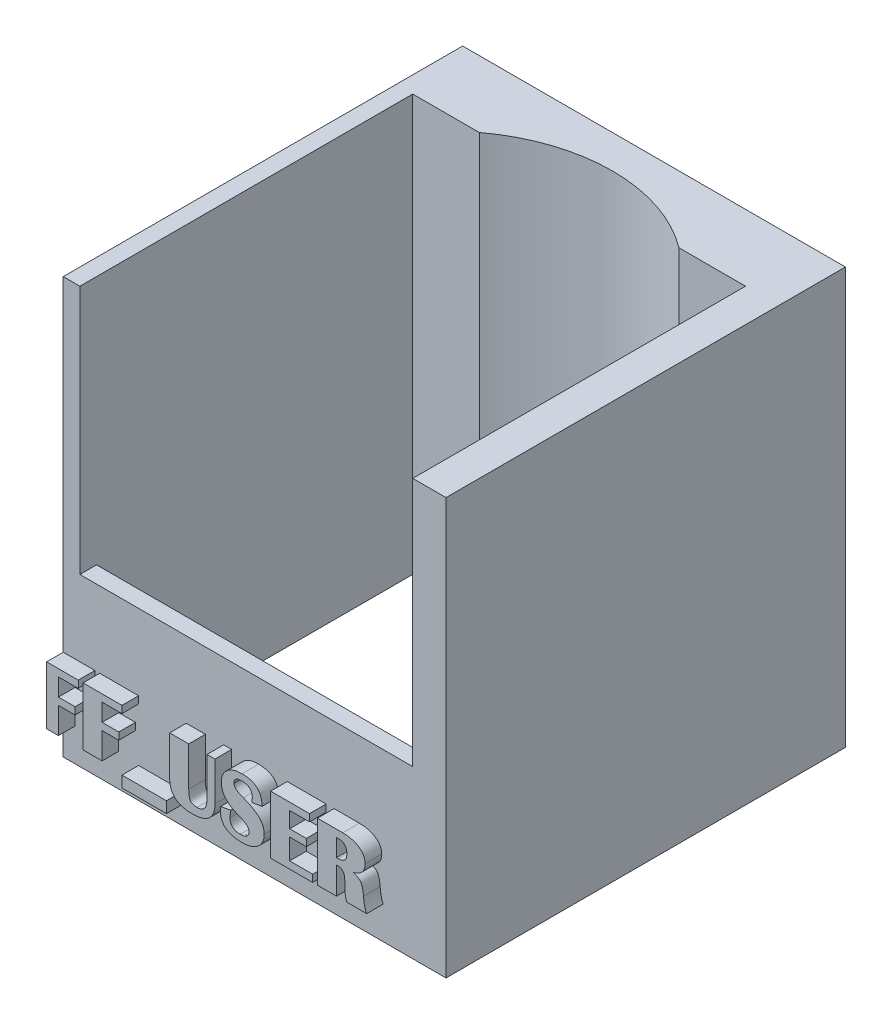
from build123d import *

# Parameters (mm, degrees)
SKETCH1_W                      = 670
SKETCH1_H                      = 120
BOSS_EXTRUDE1_DEPTH            = 530
SKETCH2_W                      = 100
SKETCH2_H                      = 200
SKETCH2_W_2                    = 650
SKETCH2_H_2                    = 250
CUT_EXTRUDE1_DEPTH             = 100
SKETCH3_R                      = 50
CUT_EXTRUDE2_DEPTH             = 260
F_12_0_12_DIAMETER_HOLE2_D     = 12
F_12_0_12_DIAMETER_HOLE2_DEPTH = 30
F_12_0_12_DIAMETER_HOLE2_TIP   = 3.605163714
SKETCH8_W                      = 650
SKETCH8_H                      = 50
BOSS_EXTRUDE2_DEPTH            = 5
SKETCH9_W                      = 10
SKETCH9_H                      = 250
CUT_EXTRUDE3_DEPTH             = 717
CUT_EXTRUDE4_DEPTH             = 5
SKETCH11_W                     = 10
SKETCH11_H                     = 100
BOSS_EXTRUDE3_DEPTH            = 78
BOSS_EXTRUDE3_2_DEPTH          = 78
BOSS_EXTRUDE3_3_DEPTH          = 78
SKETCH12_W                     = 20
SKETCH12_H                     = 30
CUT_EXTRUDE5_DEPTH             = 80
SKETCH15_W                     = 30
SKETCH15_H                     = 23.536156656
SKETCH15_H_2                   = 28.986603691
CUT_EXTRUDE7_DEPTH             = 35
SHELL1_T                       = -3
SKETCH16_W                     = 14
SKETCH16_H                     = 14
CUT_EXTRUDE8_DEPTH             = 35
SKETCH17_W                     = 5.729882812
SKETCH17_H                     = 17.428393554
SKETCH17_W_2                   = 13.369726562
SKETCH17_H_2                   = 3.342431641
BOSS_EXTRUDE4_DEPTH            = 5
SKETCH18_W                     = 670
SKETCH18_H                     = 280
CUT_EXTRUDE10_DEPTH            = 159
CUT_EXTRUDE12_DEPTH            = 59
CUT_EXTRUDE12_DEPTH_BACK       = 135
SKETCH19_W                     = 555
SKETCH19_H                     = 250
CUT_EXTRUDE13_DEPTH            = 863.670273187
CUT_EXTRUDE13_DEPTH_BACK       = 863.670273187
SKETCH20_W                     = 115
SKETCH20_H                     = 125


with BuildPart() as part:
    # Sketch1 → Boss-Extrude1 (new body)
    with BuildSketch(Plane(origin=(0, 0, 0), x_dir=(1, 0, 0), z_dir=(0, 1, 0))):
        with Locations((335, 60)):
            Rectangle(SKETCH1_W, SKETCH1_H)
    extrude(amount=BOSS_EXTRUDE1_DEPTH)

    # Sketch2 → Cut-Extrude1 (cut)
    with BuildSketch(Plane.XY):
        with Locations((60, 380)):
            Rectangle(SKETCH2_W, SKETCH2_H)
        with Locations((170, 380)):
            Rectangle(SKETCH2_W, SKETCH2_H)
        with Locations((280, 380)):
            Rectangle(SKETCH2_W, SKETCH2_H)
        with Locations((390, 380)):
            Rectangle(SKETCH2_W, SKETCH2_H)
        with Locations((500, 380)):
            Rectangle(SKETCH2_W, SKETCH2_H)
        with Locations((610, 380)):
            Rectangle(SKETCH2_W, SKETCH2_H)
        with Locations((335, 135)):
            Rectangle(SKETCH2_W_2, SKETCH2_H_2)
    extrude(amount=-CUT_EXTRUDE1_DEPTH, mode=Mode.SUBTRACT)

    # Sketch3 → Cut-Extrude2 (cut)
    with BuildSketch(Plane(origin=(0, 530, 0), x_dir=(1, 0, 0), z_dir=(0, 1, 0))):
        with Locations(Location((60, 60, 0), (0, 0, 270))):
            Circle(SKETCH3_R)
        with Locations(Location((170, 60, 0), (0, 0, 270))):
            Circle(SKETCH3_R)
        with Locations(Location((280, 60, 0), (0, 0, 270))):
            Circle(SKETCH3_R)
        with Locations(Location((390, 60, 0), (0, 0, 270))):
            Circle(SKETCH3_R)
        with Locations(Location((500, 60, 0), (0, 0, 270))):
            Circle(SKETCH3_R)
        with Locations(Location((610, 60, 0), (0, 0, 270))):
            Circle(SKETCH3_R)
    extrude(amount=-CUT_EXTRUDE2_DEPTH, mode=Mode.SUBTRACT)

    # Ø12.0 (12) Diameter Hole2
    with Locations(Plane(origin=(59.704642413, 270, -102.411697903), x_dir=(0, 0, 1), z_dir=(0, 1, 0))):
        with Locations((0, 0), (-0.195888006, 111.8520513), (0.014838595, 221.167624818), (-0.341843303, 331.364008353), (0.657723149, 441.008646429), (1.288998006, 549.811854685)):
            Hole(F_12_0_12_DIAMETER_HOLE2_D / 2, depth=F_12_0_12_DIAMETER_HOLE2_DEPTH)
            with Locations((0, 0, -(F_12_0_12_DIAMETER_HOLE2_DEPTH + F_12_0_12_DIAMETER_HOLE2_TIP / 2))):  # 118° drill point
                Cone(0, F_12_0_12_DIAMETER_HOLE2_D / 2, F_12_0_12_DIAMETER_HOLE2_TIP, mode=Mode.SUBTRACT)

    # Sketch8 → Boss-Extrude2 (add)
    with BuildSketch(Plane.XY):
        with Locations((335, 305)):
            Rectangle(SKETCH8_W, SKETCH8_H)
    extrude(amount=-BOSS_EXTRUDE2_DEPTH)

    # Sketch9 → Cut-Extrude3 (cut)
    with BuildSketch(Plane(origin=(670, 0, 0), x_dir=(0, 0, -1), z_dir=(1, 0, 0))):
        with Locations((15, 135)):
            Rectangle(SKETCH9_W, SKETCH9_H)
    extrude(amount=-CUT_EXTRUDE3_DEPTH, mode=Mode.SUBTRACT)

    # Sketch10 → Cut-Extrude4 (cut)
    with BuildSketch(Plane(origin=(0, 10, 0), x_dir=(1, 0, 0), z_dir=(0, 1, 0))):
        Polygon((365, 61.943560596), (350, 87.924322709), (320, 87.924322709), (305, 61.943560596), (320, 35.962798482), (350, 35.962798482), align=None)
    extrude(amount=-CUT_EXTRUDE4_DEPTH, mode=Mode.SUBTRACT)

    # Sketch12 → Cut-Extrude5 (cut)
    with BuildSketch(Plane.XY.offset(-100)):
        with Locations((85.198613037, 245)):
            Rectangle(SKETCH12_W, SKETCH12_H)
        with Locations((195.198613037, 245)):
            Rectangle(SKETCH12_W, SKETCH12_H)
        with Locations((305.198613037, 245)):
            Rectangle(SKETCH12_W, SKETCH12_H)
        with Locations((415.198613037, 245)):
            Rectangle(SKETCH12_W, SKETCH12_H)
        with Locations((525.198613037, 245)):
            Rectangle(SKETCH12_W, SKETCH12_H)
        with Locations((635.198613037, 245)):
            Rectangle(SKETCH12_W, SKETCH12_H)
    extrude(amount=-CUT_EXTRUDE5_DEPTH, mode=Mode.SUBTRACT)

    # Sketch17 → Boss-Extrude4 (add)
    # profile 1 of 9: a face of its own
    with BuildSketch(Plane.XY):
        with BuildLine():
            Line((527.508830928, 289.835452458), (527.508830928, 307.263846012))
            Line((527.508830928, 307.263846012), (534.861434459, 307.263846012))
            add(Edge.make_bspline(
                [(534.861434459, 307.263846012), (535.181337774, 307.258256848), (535.803061116, 307.24739446), (536.703508491, 307.139069344), (537.544992916, 306.975202489), (538.325061607, 306.737496792), (539.040841948, 306.426020155), (539.698044515, 306.051894954), (540.290333057, 305.605079277), (540.822348212, 305.090232636), (541.284521701, 304.502523111), (541.692171296, 303.852565801), (542.030284458, 303.129762281), (542.309377095, 302.341316546), (542.5243908, 301.484161689), (542.679660381, 300.560045938), (542.773357357, 299.567500804), (542.783368073, 298.883107022), (542.788518428, 298.530997273)],
                knots=[0, 0, 0, 0, 1.135059408, 2.20595691, 3.214417064, 4.174978569, 5.094187092, 5.980001006, 6.853065862, 7.720814779, 8.600404634, 9.50058483, 10.438414914, 11.426825708, 12.465239141, 13.571113463, 14.750376389, 16, 16, 16, 16], degree=3))
            add(Edge.make_bspline(
                [(542.788518428, 298.530997273), (542.781740751, 298.180151665), (542.768592871, 297.499553336), (542.676885992, 296.511518461), (542.516733301, 295.591080531), (542.296748778, 294.736450427), (542.003051046, 293.953120444), (541.654236167, 293.233205539), (541.233025793, 292.585291498), (540.753136904, 292.000029304), (540.204772188, 291.484681411), (539.587651059, 291.044279297), (538.910779309, 290.668464036), (538.169670382, 290.361903209), (537.364073889, 290.124869172), (536.495133477, 289.954199984), (535.562644449, 289.853487388), (534.920131033, 289.841584621), (534.58911581, 289.835452458)],
                knots=[0, 0, 0, 0, 1.228418252, 2.382983832, 3.470276728, 4.496757894, 5.468023682, 6.394867725, 7.292157164, 8.167372942, 9.039072913, 9.918728341, 10.815246345, 11.744296628, 12.720973084, 13.750736166, 14.841206188, 16, 16, 16, 16], degree=3))
            Line((534.58911581, 289.835452458), (527.508830928, 289.835452458))
        make_face()
        with BuildLine():
            Line((533.238713741, 291.745413395), (534.048208904, 291.745413395))
            add(Edge.make_bspline(
                [(534.048208904, 291.745413395), (534.172894012, 291.749291978), (534.413033311, 291.756761998), (534.758676231, 291.825976613), (535.075745017, 291.938271137), (535.365749176, 292.094802589), (535.623404602, 292.300450923), (535.848862806, 292.551404902), (536.04776914, 292.844737637), (536.217685755, 293.190205032), (536.364284647, 293.596533622), (536.481764702, 294.076367921), (536.592118304, 294.630928744), (536.673672739, 295.265507643), (536.740044562, 295.978448886), (536.788346679, 296.768428292), (536.812018936, 297.636801208), (536.817188964, 298.241258393), (536.819890499, 298.55711002)],
                knots=[0, 0, 0, 0, 0.728710832, 1.403472396, 2.052289494, 2.690292559, 3.321919393, 3.970736491, 4.656696891, 5.388631723, 6.217040872, 7.17856157, 8.275589967, 9.523440737, 10.918935818, 12.463926104, 14.152268318, 16, 16, 16, 16], degree=3))
            add(Edge.make_bspline(
                [(536.819890499, 298.55711002), (536.8171426, 298.871715251), (536.811863063, 299.476166083), (536.7886758, 300.343334385), (536.739579947, 301.133216935), (536.674703848, 301.843934916), (536.589660404, 302.476324031), (536.488366458, 303.031681737), (536.362441588, 303.507627045), (536.222158727, 303.914921549), (536.050140993, 304.256514038), (535.858357073, 304.554097881), (535.62547107, 304.79746827), (535.36991257, 305.004888479), (535.079348843, 305.160875844), (534.761320266, 305.273944358), (534.414185903, 305.34216807), (534.172870641, 305.349893944), (534.048208904, 305.353885075)],
                knots=[0, 0, 0, 0, 1.842836665, 3.540640921, 5.080358154, 6.47765669, 7.719902824, 8.816971715, 9.781579111, 10.601733135, 11.334613876, 12.017393917, 12.666641099, 13.29908421, 13.937911793, 14.587567384, 15.270347425, 16, 16, 16, 16], degree=3))
            Line((534.048208904, 305.353885075), (533.238713741, 305.353885075))
            Line((533.238713741, 305.353885075), (533.238713741, 291.745413395))
        make_face(mode=Mode.SUBTRACT)
    # profile 2 of 9: a face of its own
    with BuildSketch(Plane.XY):
        with Locations((547.563420772, 298.549649235)):
            Rectangle(SKETCH17_W, SKETCH17_H)
    # profile 3 of 9: a face of its own
    with BuildSketch(Plane.XY):
        Polygon((564.514324092, 307.263846012), (564.514324092, 305.115139958), (558.545696163, 305.115139958), (558.545696163, 299.862747379), (563.559343624, 299.862747379), (563.559343624, 297.714041325), (558.545696163, 297.714041325), (558.545696163, 289.835452458), (552.81581335, 289.835452458), (552.81581335, 307.263846012), align=None)
    # profile 4 of 9: a face of its own
    with BuildSketch(Plane.XY):
        Polygon((577.645305538, 307.263846012), (577.645305538, 305.115139958), (571.676677608, 305.115139958), (571.676677608, 299.862747379), (576.690325069, 299.862747379), (576.690325069, 297.714041325), (571.676677608, 297.714041325), (571.676677608, 289.835452458), (565.946794795, 289.835452458), (565.946794795, 307.263846012), align=None)
    # profile 5 of 9: a face of its own
    with BuildSketch(Plane.XY):
        with Locations((584.330168819, 287.448001286)):
            Rectangle(SKETCH17_W_2, SKETCH17_H_2)
    # profile 6 of 9: a face of its own
    with BuildSketch(Plane.XY):
        with BuildLine():
            Line((605.578484249, 307.263846012), (605.578484249, 295.602639195))
            add(Edge.make_bspline(
                [(605.578484249, 295.602639195), (605.574209777, 295.35989389), (605.565919345, 294.889083964), (605.480877158, 294.20653885), (605.349958188, 293.569747554), (605.15926554, 292.978838165), (604.911867049, 292.436847071), (604.616163877, 291.936663973), (604.260702644, 291.487723021), (603.847299908, 291.08966617), (603.386881991, 290.731670113), (602.867295001, 290.425440037), (602.293741958, 290.168488385), (601.66690529, 289.960990771), (600.988052682, 289.797299786), (600.254912883, 289.679078851), (599.467035781, 289.60781007), (598.923618241, 289.60048219), (598.643684673, 289.59670734)],
                knots=[0, 0, 0, 0, 1.108173197, 2.149326602, 3.136215123, 4.073726706, 4.978516626, 5.852185058, 6.72141202, 7.584905625, 8.467554395, 9.379216169, 10.332422268, 11.332766067, 12.390653242, 13.518530507, 14.721707419, 16, 16, 16, 16], degree=3))
            add(Edge.make_bspline(
                [(598.643684673, 289.59670734), (598.373688491, 289.600411437), (597.851346557, 289.607577482), (597.093280473, 289.679448684), (596.387523889, 289.797736542), (595.733050135, 289.960122315), (595.130189942, 290.169220301), (594.579048171, 290.42623041), (594.078350789, 290.732835498), (593.633858028, 291.090104794), (593.234289459, 291.486851767), (592.899913678, 291.940746827), (592.609043638, 292.435866034), (592.375223767, 292.980322997), (592.191754821, 293.570441519), (592.063541006, 294.20666921), (591.983676196, 294.889343196), (591.974661767, 295.359932437), (591.970012569, 295.602639195)],
                knots=[0, 0, 0, 0, 1.258901956, 2.435505865, 3.547148904, 4.59359074, 5.576649289, 6.5183682, 7.424469602, 8.307507093, 9.172751023, 10.042627298, 10.928839176, 11.845659241, 12.799442865, 13.80597989, 14.868432463, 16, 16, 16, 16], degree=3))
            Line((591.970012569, 295.602639195), (591.970012569, 307.263846012))
            Line((591.970012569, 307.263846012), (597.699895381, 307.263846012))
            Line((597.699895381, 307.263846012), (597.699895381, 295.457153889))
            add(Edge.make_bspline(
                [(597.699895381, 295.457153889), (597.700816195, 295.287996189), (597.702584578, 294.963135903), (597.729908723, 294.499051493), (597.768241004, 294.079064133), (597.828226169, 293.705517832), (597.90066041, 293.377063412), (597.989882091, 293.09281535), (598.094998068, 292.852496478), (598.225239063, 292.654232043), (598.380826623, 292.495135011), (598.55368342, 292.353231761), (598.757556996, 292.238543846), (598.987648905, 292.146224908), (599.243380948, 292.070549638), (599.526120553, 292.020376099), (599.83553351, 291.990763905), (600.049971942, 291.986424568), (600.161954402, 291.984158512)],
                knots=[0, 0, 0, 0, 1.622370975, 3.115695595, 4.458049099, 5.666011203, 6.742434742, 7.681714947, 8.519814998, 9.250928664, 9.942747364, 10.646898194, 11.389596108, 12.175933929, 13.021386247, 13.943159715, 14.925891993, 16, 16, 16, 16], degree=3))
            add(Edge.make_bspline(
                [(600.161954402, 291.984158512), (600.283927219, 291.987190593), (600.521124756, 291.993087005), (600.86597014, 292.03390861), (601.187714881, 292.103380086), (601.484890424, 292.205377303), (601.758665297, 292.332852529), (602.012761516, 292.484567923), (602.236391413, 292.674631152), (602.439076761, 292.888441291), (602.620738276, 293.128529789), (602.771757722, 293.399928575), (602.905501548, 293.697121508), (603.005823683, 294.025060118), (603.089837826, 294.379999499), (603.146989706, 294.763086929), (603.186210275, 295.174074524), (603.189394751, 295.457053988), (603.191033077, 295.602639195)],
                knots=[0, 0, 0, 0, 1.083870311, 2.107775948, 3.08105344, 4.003637981, 4.893545291, 5.761570557, 6.624657808, 7.49233129, 8.376387281, 9.291996285, 10.246843261, 11.267344133, 12.334180325, 13.486053461, 14.706643157, 16, 16, 16, 16], degree=3))
            Line((603.191033077, 295.602639195), (603.191033077, 307.263846012))
            Line((603.191033077, 307.263846012), (605.578484249, 307.263846012))
        make_face()
    # profile 7 of 9: a face of its own
    with BuildSketch(Plane.XY):
        with BuildLine():
            Line((619.731593227, 302.015183827), (616.739818477, 301.526502415))
            add(Edge.make_bspline(
                [(616.739818477, 301.526502415), (616.748849224, 301.670726223), (616.765660669, 301.939210177), (616.78429066, 302.312269209), (616.796668381, 302.625642376), (616.798628236, 302.814722915), (616.799504756, 302.899286839)],
                knots=[0, 0, 0, 0, 1.261802504, 2.348944521, 3.261585937, 4, 4, 4, 4], degree=3))
            add(Edge.make_bspline(
                [(616.799504756, 302.899286839), (616.798306068, 303.007660677), (616.795968139, 303.219033721), (616.750451916, 303.523894877), (616.694806916, 303.811547356), (616.604352699, 304.076787391), (616.488181329, 304.320314265), (616.348943917, 304.543955606), (616.184187178, 304.745078709), (615.995833421, 304.928129987), (615.778009957, 305.083200131), (615.536269472, 305.218702836), (615.269765326, 305.333844758), (614.978065514, 305.431346685), (614.660683072, 305.504624438), (614.319025281, 305.556776695), (613.952471696, 305.585673441), (613.699597795, 305.590260771), (613.568984889, 305.592630192)],
                knots=[0, 0, 0, 0, 1.079280541, 2.105035848, 3.067950317, 3.99715044, 4.889989748, 5.753421302, 6.617030865, 7.476358039, 8.364190572, 9.274590025, 10.235106994, 11.254473582, 12.337095886, 13.478601727, 14.697662529, 16, 16, 16, 16], degree=3))
            add(Edge.make_bspline(
                [(613.568984889, 305.592630192), (613.391954632, 305.58912286), (613.059112606, 305.582528579), (612.595688488, 305.495339748), (612.198743126, 305.361419257), (611.87165349, 305.163811893), (611.613188167, 304.909795747), (611.433841092, 304.593316589), (611.323009072, 304.224665915), (611.313400221, 303.959558324), (611.308367061, 303.820693775)],
                knots=[0, 0, 0, 0, 1.294917039, 2.43462794, 3.440028966, 4.347597256, 5.210608309, 6.06356377, 6.985685997, 8, 8, 8, 8], degree=3))
            add(Edge.make_bspline(
                [(611.308367061, 303.820693775), (611.317562032, 303.705133219), (611.336106628, 303.472068433), (611.47315858, 303.132808312), (611.695999602, 302.811560885), (612.009295906, 302.510664216), (612.404107796, 302.221967273), (612.884407504, 301.948533431), (613.450813789, 301.688189695), (613.862519081, 301.536023727), (614.080048656, 301.455624958)],
                knots=[0, 0, 0, 0, 0.716839541, 1.445735977, 2.240793036, 3.131329288, 4.131129903, 5.273471266, 6.559404876, 8, 8, 8, 8], degree=3))
            add(Edge.make_bspline(
                [(614.080048656, 301.455624958), (614.335934702, 301.364918412), (614.834564244, 301.188164095), (615.547657928, 300.88707802), (616.213068388, 300.5749594), (616.829579094, 300.246613346), (617.397833174, 299.90520698), (617.914851624, 299.544556457), (618.386199073, 299.173962102), (618.807001026, 298.783874588), (619.177995113, 298.378100064), (619.4958685, 297.952745357), (619.771807525, 297.51723103), (619.991113975, 297.061458502), (620.169645242, 296.594624218), (620.292698657, 296.11024444), (620.364288243, 295.609761088), (620.37516617, 295.270864226), (620.380681514, 295.099036213)],
                knots=[0, 0, 0, 0, 1.359488612, 2.649152603, 3.874964776, 5.039588756, 6.146130126, 7.193090393, 8.194917302, 9.146793662, 10.063845301, 10.944476293, 11.803344532, 12.641736646, 13.473440096, 14.302714936, 15.139439897, 16, 16, 16, 16], degree=3))
            add(Edge.make_bspline(
                [(620.380681514, 295.099036213), (620.374476075, 294.902306495), (620.362285176, 294.515820995), (620.280160209, 293.948630617), (620.138011896, 293.409496554), (619.938489338, 292.895972278), (619.681049879, 292.411946655), (619.366518754, 291.954381076), (618.996510229, 291.525099427), (618.5710008, 291.128381035), (618.102222518, 290.765302239), (617.587803957, 290.450854345), (617.034458515, 290.187092261), (616.444107988, 289.968993032), (615.81453624, 289.801373099), (615.145337453, 289.685291013), (614.438790193, 289.606619894), (613.954683001, 289.600062276), (613.70700941, 289.59670734)],
                knots=[0, 0, 0, 0, 0.972121714, 1.909782367, 2.824924061, 3.721832975, 4.62620438, 5.527836938, 6.46026819, 7.421000932, 8.398101015, 9.385579713, 10.394244048, 11.422703992, 12.491421888, 13.608778581, 14.776629625, 16, 16, 16, 16], degree=3))
            add(Edge.make_bspline(
                [(613.70700941, 289.59670734), (613.445745367, 289.599650312), (612.939893069, 289.605348413), (612.207608113, 289.66709241), (611.525297432, 289.760984454), (610.893395078, 289.899706116), (610.309273131, 290.072394336), (609.776099392, 290.288320955), (609.295310255, 290.547303481), (608.863217672, 290.843007892), (608.478306623, 291.175775461), (608.148120946, 291.551766865), (607.86942369, 291.967163224), (607.639947144, 292.421521488), (607.466477665, 292.917583541), (607.339164663, 293.449829748), (607.264537999, 294.021332449), (607.254747521, 294.414908557), (607.249700069, 294.617815586)],
                knots=[0, 0, 0, 0, 1.342201143, 2.598733168, 3.773451092, 4.878874364, 5.91991243, 6.900006476, 7.829142054, 8.72062616, 9.585588575, 10.436728592, 11.283829734, 12.149664931, 13.044964919, 13.977937424, 14.957531465, 16, 16, 16, 16], degree=3))
            add(Edge.make_bspline(
                [(607.249700069, 294.617815586), (607.250803815, 294.692425759), (607.253213998, 294.855347393), (607.260452266, 295.122772538), (607.275636683, 295.433682216), (607.29037174, 295.656130545), (607.298195171, 295.774237248)],
                knots=[0, 0, 0, 0, 0.773500207, 1.689044709, 2.77302154, 4, 4, 4, 4], degree=3))
            Line((607.298195171, 295.774237248), (610.36457777, 296.337526509))
            add(Edge.make_bspline(
                [(610.36457777, 296.337526509), (610.326952988, 296.136337493), (610.255606535, 295.754830366), (610.178678473, 295.21219969), (610.124206629, 294.733311493), (610.11767002, 294.435147371), (610.114641475, 294.297001835)],
                knots=[0, 0, 0, 0, 1.192988372, 2.262218769, 3.194850416, 4, 4, 4, 4], degree=3))
            add(Edge.make_bspline(
                [(610.114641475, 294.297001835), (610.116191817, 294.183708768), (610.119182568, 293.965156219), (610.159053378, 293.648552813), (610.215988606, 293.352999663), (610.302906772, 293.079707227), (610.411206928, 292.826307836), (610.544682453, 292.59538211), (610.704385489, 292.386485019), (610.887496571, 292.200099922), (611.094689168, 292.033628705), (611.327456494, 291.892756696), (611.58347653, 291.771733922), (611.864681562, 291.677479524), (612.167961721, 291.596080628), (612.497219749, 291.548235723), (612.849461228, 291.512043782), (613.092629543, 291.508500084), (613.218327999, 291.506668278)],
                knots=[0, 0, 0, 0, 1.135776692, 2.191015738, 3.19649269, 4.151244236, 5.061952528, 5.956281389, 6.819534407, 7.692823504, 8.571441916, 9.478554956, 10.416037156, 11.406231466, 12.450054172, 13.561596327, 14.739541482, 16, 16, 16, 16], degree=3))
            add(Edge.make_bspline(
                [(613.218327999, 291.506668278), (613.423996012, 291.510791273), (613.810619321, 291.518541853), (614.349272542, 291.616708407), (614.810575885, 291.768742445), (615.189785268, 291.991387532), (615.490778961, 292.278756613), (615.698005174, 292.637320004), (615.824813318, 293.05638326), (615.837728413, 293.355975238), (615.844524288, 293.513619419)],
                knots=[0, 0, 0, 0, 1.308765556, 2.460272085, 3.475015317, 4.388076298, 5.239673503, 6.095681635, 6.997954785, 8, 8, 8, 8], degree=3))
            add(Edge.make_bspline(
                [(615.844524288, 293.513619419), (615.833808824, 293.638242951), (615.811807312, 293.894126055), (615.644884004, 294.264515838), (615.382382362, 294.620631473), (615.016807277, 294.962984909), (614.551376589, 295.293471235), (613.986957743, 295.616730224), (613.322148235, 295.933112033), (612.83677959, 296.119639164), (612.580430889, 296.21815395)],
                knots=[0, 0, 0, 0, 0.667930748, 1.371427933, 2.146459016, 3.034714139, 4.04893387, 5.207327294, 6.525042705, 8, 8, 8, 8], degree=3))
            add(Edge.make_bspline(
                [(612.580430889, 296.21815395), (612.374354345, 296.29679374), (611.970646869, 296.450850434), (611.394079385, 296.713586304), (610.853066711, 296.987016804), (610.357486361, 297.288235735), (609.896382561, 297.599610528), (609.477036946, 297.932256792), (609.09841673, 298.284556341), (608.758710772, 298.653375077), (608.457302107, 299.038989264), (608.199448649, 299.444659231), (607.977533299, 299.866789834), (607.798609588, 300.308107488), (607.65975715, 300.767821241), (607.559616231, 301.244439392), (607.497905054, 301.739995674), (607.491630423, 302.075933546), (607.488445186, 302.246468159)],
                knots=[0, 0, 0, 0, 1.249558333, 2.447906163, 3.58867143, 4.682264114, 5.731748367, 6.739728761, 7.711906036, 8.659384707, 9.578321416, 10.481344598, 11.379544271, 12.277135726, 13.175418307, 14.097160112, 15.034047388, 16, 16, 16, 16], degree=3))
            add(Edge.make_bspline(
                [(607.488445186, 302.246468159), (607.49282555, 302.439538736), (607.501402184, 302.817565692), (607.587451154, 303.36980586), (607.719291893, 303.894921371), (607.910558542, 304.389343064), (608.156192894, 304.852853762), (608.453187669, 305.288766511), (608.804241719, 305.697593471), (609.213503754, 306.066686531), (609.657214714, 306.407618241), (610.14376173, 306.697651931), (610.658716537, 306.950861947), (611.210636666, 307.148827868), (611.791820619, 307.313252612), (612.408080529, 307.421140415), (613.056315391, 307.490701612), (613.499160755, 307.498567824), (613.725661373, 307.502591129)],
                knots=[0, 0, 0, 0, 1.01033566, 1.978209831, 2.919499157, 3.840961976, 4.746855014, 5.660740114, 6.597989116, 7.56120833, 8.541877795, 9.523498025, 10.522416858, 11.542172371, 12.589598349, 13.681636521, 14.814234488, 16, 16, 16, 16], degree=3))
            add(Edge.make_bspline(
                [(613.725661373, 307.502591129), (613.968269855, 307.498219033), (614.438190994, 307.489750488), (615.120391152, 307.426787419), (615.755073228, 307.319142339), (616.345153155, 307.171557286), (616.887304575, 306.977590666), (617.384933999, 306.742393454), (617.834452216, 306.46201507), (618.236961315, 306.139451502), (618.593086714, 305.773322851), (618.897467704, 305.361641069), (619.158701245, 304.909408454), (619.366684143, 304.412232174), (619.529870326, 303.873247147), (619.649133834, 303.29158184), (619.720420497, 302.667301443), (619.72779778, 302.236712324), (619.731593227, 302.015183827)],
                knots=[0, 0, 0, 0, 1.248314423, 2.417925914, 3.521398822, 4.558068205, 5.543720209, 6.479599284, 7.385061127, 8.263440163, 9.127722873, 10.00561236, 10.891325273, 11.808802823, 12.772251995, 13.784947978, 14.860405143, 16, 16, 16, 16], degree=3))
        make_face()
    # profile 8 of 9: a face of its own
    with BuildSketch(Plane.XY):
        Polygon((633.989153194, 307.263846012), (633.989153194, 305.115139958), (628.020525264, 305.115139958), (628.020525264, 300.340237614), (633.034172725, 300.340237614), (633.034172725, 298.191531559), (628.020525264, 298.191531559), (628.020525264, 291.984158512), (634.944133663, 291.984158512), (634.944133663, 289.835452458), (622.290642452, 289.835452458), (622.290642452, 307.263846012), align=None)
    # profile 9 of 9: a face of its own
    with BuildSketch(Plane.XY):
        with BuildLine():
            Line((636.376604366, 289.835452458), (636.376604366, 307.263846012))
            Line((636.376604366, 307.263846012), (643.990335369, 307.263846012))
            add(Edge.make_bspline(
                [(643.990335369, 307.263846012), (644.237946498, 307.261150834), (644.721600887, 307.25588639), (645.426490561, 307.189203683), (646.094808274, 307.090496236), (646.724915796, 306.949857504), (647.317873659, 306.767252686), (647.871119087, 306.542146), (648.390701058, 306.282329135), (648.864494846, 305.976472528), (649.295093616, 305.642889252), (649.669668547, 305.279483604), (649.990389523, 304.894749072), (650.250664962, 304.483256345), (650.454275633, 304.048690948), (650.59581384, 303.587791605), (650.684089268, 303.104102537), (650.695510601, 302.772834174), (650.701311397, 302.604585835)],
                knots=[0, 0, 0, 0, 1.303269877, 2.545653735, 3.724355284, 4.8584284, 5.941462088, 6.987020715, 8.000098032, 8.995332524, 9.951400474, 10.863507538, 11.737823931, 12.582415999, 13.420128714, 14.25671499, 15.114600608, 16, 16, 16, 16], degree=3))
            add(Edge.make_bspline(
                [(650.701311397, 302.604585835), (650.698282873, 302.472674957), (650.692382063, 302.215658276), (650.651041486, 301.838684287), (650.580643818, 301.480313933), (650.481036683, 301.139915259), (650.347814833, 300.820175594), (650.191279492, 300.517863507), (650.009772227, 300.230553342), (649.788675198, 299.970497982), (649.548268341, 299.722842359), (649.274558803, 299.497116911), (648.974487035, 299.288655528), (648.642526299, 299.104010513), (648.287619671, 298.928055749), (647.899038177, 298.784921972), (647.486819978, 298.644749395), (647.19793098, 298.577036306), (647.049257183, 298.54218845)],
                knots=[0, 0, 0, 0, 1.057156483, 2.059775939, 3.035078039, 3.981068617, 4.897189472, 5.80650904, 6.70770952, 7.613691521, 8.536886357, 9.470937334, 10.45233069, 11.461024139, 12.51295332, 13.623444893, 14.776929983, 16, 16, 16, 16], degree=3))
            add(Edge.make_bspline(
                [(647.049257183, 298.54218845), (647.19164695, 298.499279419), (647.467865022, 298.416041346), (647.856360945, 298.265600017), (648.211652989, 298.111536308), (648.524185739, 297.936781388), (648.807636894, 297.762122504), (649.047122259, 297.564301324), (649.255235567, 297.361673563), (649.425188343, 297.135464734), (649.570253643, 296.882344437), (649.694827156, 296.586596707), (649.815179167, 296.247423665), (649.917667348, 295.859098311), (650.004750555, 295.423699276), (650.088222437, 294.944027189), (650.153853601, 294.416024546), (650.187587341, 294.048412906), (650.2051692, 293.856815525)],
                knots=[0, 0, 0, 0, 1.149282524, 2.229462177, 3.219229774, 4.139917433, 4.995948464, 5.788695735, 6.536448429, 7.236319808, 7.968460079, 8.78645307, 9.713791991, 10.749194692, 11.887975363, 13.146018663, 14.512518948, 16, 16, 16, 16], degree=3))
            add(Edge.make_bspline(
                [(650.2051692, 293.856815525), (650.225980287, 293.627849833), (650.265975604, 293.187817268), (650.348933081, 292.554613589), (650.44386163, 291.974357025), (650.555874504, 291.44528724), (650.681301216, 290.967898855), (650.821280597, 290.540469593), (650.979920039, 290.165788217), (651.10484481, 289.941461656), (651.163880062, 289.835452458)],
                knots=[0, 0, 0, 0, 1.324580516, 2.545615266, 3.678710841, 4.711533017, 5.660403917, 6.521349952, 7.301239649, 8, 8, 8, 8], degree=3))
            Line((651.163880062, 289.835452458), (645.213904094, 289.835452458))
            add(Edge.make_bspline(
                [(645.213904094, 289.835452458), (645.12229736, 290.069847279), (644.935171241, 290.548648246), (644.7595281, 291.319414791), (644.64846922, 292.142514735), (644.635117598, 292.70994511), (644.628232479, 293.002555653)],
                knots=[0, 0, 0, 0, 0.930410518, 1.900560147, 2.917368081, 4, 4, 4, 4], degree=3))
            Line((644.628232479, 293.002555653), (644.605850124, 294.002300831))
            Line((644.605850124, 294.002300831), (644.579737377, 295.266903874))
            add(Edge.make_bspline(
                [(644.579737377, 295.266903874), (644.573694669, 295.477395004), (644.562357007, 295.872330118), (644.469348432, 296.426164013), (644.30178735, 296.894645884), (644.073222546, 297.287223005), (643.766741442, 297.590613479), (643.39104803, 297.804152917), (642.950456912, 297.93396284), (642.634664848, 297.946292392), (642.468335247, 297.952786442)],
                knots=[0, 0, 0, 0, 1.295300309, 2.430314163, 3.439929415, 4.342995669, 5.203512789, 6.060756153, 6.978588463, 8, 8, 8, 8], degree=3))
            Line((642.468335247, 297.952786442), (642.106487178, 297.952786442))
            Line((642.106487178, 297.952786442), (642.106487178, 289.835452458))
            Line((642.106487178, 289.835452458), (636.376604366, 289.835452458))
        make_face()
        with BuildLine():
            Line((642.106487178, 299.862747379), (642.617550945, 299.862747379))
            add(Edge.make_bspline(
                [(642.617550945, 299.862747379), (642.722054451, 299.865172716), (642.925280724, 299.869889229), (643.220054897, 299.898289891), (643.494111408, 299.951809873), (643.749840966, 300.021017819), (643.984372137, 300.114851792), (644.200147241, 300.225818296), (644.391160406, 300.362685327), (644.565327067, 300.516342321), (644.718148635, 300.691986294), (644.850351299, 300.889034217), (644.961199162, 301.106225057), (645.056078491, 301.342818683), (645.125883912, 301.600830857), (645.173262731, 301.879472914), (645.203404658, 302.177423605), (645.207875435, 302.383174491), (645.210173702, 302.488943669)],
                knots=[0, 0, 0, 0, 1.184986479, 2.304423995, 3.352332712, 4.347714965, 5.303263624, 6.211353909, 7.091434645, 7.960150225, 8.839440182, 9.723126897, 10.64371617, 11.599264829, 12.608232147, 13.667459739, 14.800924404, 16, 16, 16, 16], degree=3))
            add(Edge.make_bspline(
                [(645.210173702, 302.488943669), (645.207875435, 302.594712847), (645.203404658, 302.800463732), (645.173262731, 303.098414423), (645.125883912, 303.37705648), (645.056078491, 303.635068654), (644.961199162, 303.87166228), (644.850351299, 304.08885312), (644.718148635, 304.285901043), (644.565327067, 304.461545017), (644.391160406, 304.61520201), (644.200147241, 304.752069041), (643.984372137, 304.863035546), (643.749840966, 304.956869518), (643.494111408, 305.026077464), (643.220054897, 305.079597446), (642.925280724, 305.107998108), (642.722054451, 305.112714621), (642.617550945, 305.115139958)],
                knots=[0, 0, 0, 0, 1.199075596, 2.332540261, 3.391767853, 4.400735171, 5.35628383, 6.276873103, 7.160559818, 8.039849775, 8.908565355, 9.788646091, 10.696736376, 11.652285035, 12.647667288, 13.695576005, 14.815013521, 16, 16, 16, 16], degree=3))
            Line((642.617550945, 305.115139958), (642.106487178, 305.115139958))
            Line((642.106487178, 305.115139958), (642.106487178, 299.862747379))
        make_face(mode=Mode.SUBTRACT)
    extrude(amount=BOSS_EXTRUDE4_DEPTH)


with BuildPart() as body_2:
    # Sketch11 → Boss-Extrude3 (new body)
    with BuildSketch(Plane.XY.offset(-100)):
        with Locations((255, 60)):
            Rectangle(SKETCH11_W, SKETCH11_H)
    extrude(amount=BOSS_EXTRUDE3_DEPTH)


with BuildPart() as body_3:
    # Sketch11 → Boss-Extrude3 2 (new body)
    with BuildSketch(Plane.XY.offset(-100)):
        with Locations((415, 60)):
            Rectangle(SKETCH11_W, SKETCH11_H)
    extrude(amount=BOSS_EXTRUDE3_2_DEPTH)


with BuildPart() as body_4:
    # Sketch11 → Boss-Extrude3 3 (new body)
    with BuildSketch(Plane.XY.offset(-100)):
        Polygon((25, 198.45686471), (325, 145.558770497), (325, 122.01775856), (345, 122.01775856), (345, 145.558770497), (645, 198.45686471), align=None)
    extrude(amount=BOSS_EXTRUDE3_3_DEPTH)

    # Sketch15 → Cut-Extrude7 (cut)
    with BuildSketch(Plane(origin=(345, 0, 0), x_dir=(0, 0, -1), z_dir=(1, 0, 0))):
        with Locations((35, 133.231921672)):
            Rectangle(SKETCH15_W, SKETCH15_H)
        with Locations((85, 130.506698154)):
            Rectangle(SKETCH15_W, SKETCH15_H_2)
    extrude(amount=-CUT_EXTRUDE7_DEPTH, mode=Mode.SUBTRACT)

    # Shell1
    shell1_openings = [body_4.faces().sort_by_distance(p)[0] for p in [
        (335, 198.45686471, -61),
    ]]
    offset(amount=SHELL1_T, openings=shell1_openings, kind=Kind.INTERSECTION)

    # Sketch16 → Cut-Extrude8 (cut)
    with BuildSketch(Plane.XZ.offset(-122.01775856)):
        with Locations((335, -60)):
            Rectangle(SKETCH16_W, SKETCH16_H)
    extrude(amount=-CUT_EXTRUDE8_DEPTH, mode=Mode.SUBTRACT)


with BuildPart() as cut_extrude10_tool:
    # Sketch18 → Cut-Extrude10 (new body)
    with BuildSketch(Plane.XY):
        with Locations((335, 140)):
            Rectangle(SKETCH18_W, SKETCH18_H)
    extrude(amount=-CUT_EXTRUDE10_DEPTH)


with BuildPart() as part_1:
    add(part.part)

    # Cut-Extrude10: cut by cut_extrude10_tool
    add(cut_extrude10_tool.part, mode=Mode.SUBTRACT)

    # Sketch19 → Cut-Extrude12 (cut, two sides: drawn at the far end of the back side and taken through both)
    with BuildSketch(Plane.XY.offset(-CUT_EXTRUDE12_DEPTH_BACK)):
        with Locations((277.5, 405)):
            Rectangle(SKETCH19_W, SKETCH19_H)
    extrude(amount=CUT_EXTRUDE12_DEPTH + CUT_EXTRUDE12_DEPTH_BACK, mode=Mode.SUBTRACT)

    # Sketch20 → Cut-Extrude13 (cut, two sides: drawn at the far end of the back side and taken through both)
    with BuildSketch(Plane.XY.offset(-CUT_EXTRUDE13_DEPTH_BACK)):
        with Locations((612.5, 467.5)):
            Rectangle(SKETCH20_W, SKETCH20_H)
    extrude(amount=CUT_EXTRUDE13_DEPTH + CUT_EXTRUDE13_DEPTH_BACK, mode=Mode.SUBTRACT)


with BuildPart() as body_2_1:
    add(body_2.part)

    # Cut-Extrude10: cut by cut_extrude10_tool
    add(cut_extrude10_tool.part, mode=Mode.SUBTRACT)


with BuildPart() as body_3_1:
    add(body_3.part)

    # Cut-Extrude10: cut by cut_extrude10_tool
    add(cut_extrude10_tool.part, mode=Mode.SUBTRACT)


with BuildPart() as body_4_1:
    add(body_4.part)

    # Cut-Extrude10: cut by cut_extrude10_tool
    add(cut_extrude10_tool.part, mode=Mode.SUBTRACT)


solid = part_1.part
